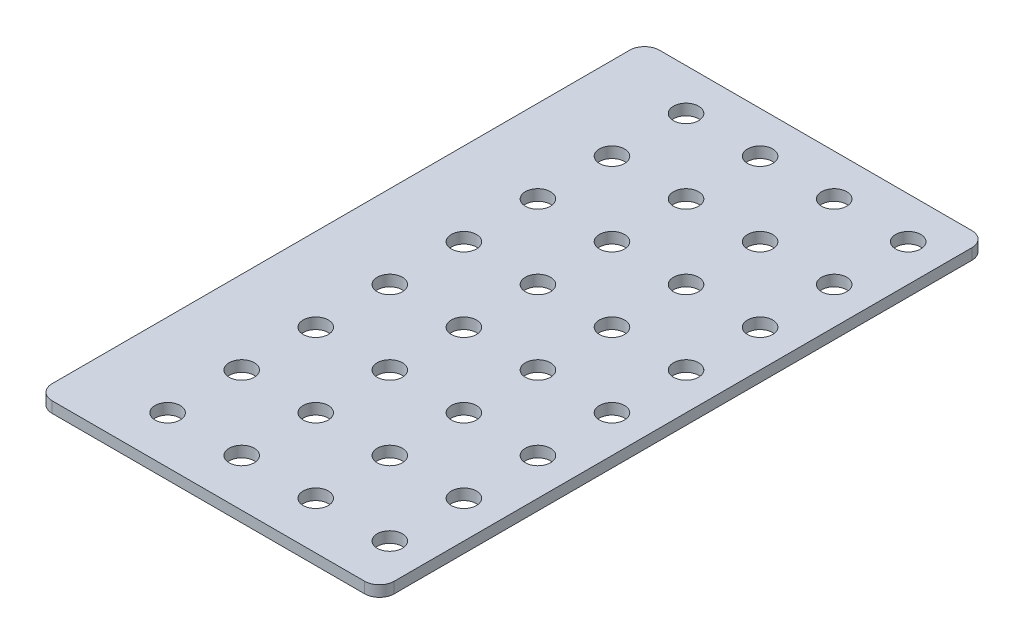
from build123d import *

# Parameters (mm, degrees)
SKETCH1_R           = 4.25
BOSS_EXTRUDE1_DEPTH = 3.7
FILLET1_R           = 5


with BuildPart() as part:
    # Sketch1 → Boss-Extrude1 (new body)
    with BuildSketch(Plane(origin=(0, 0, 0), x_dir=(1, 0, 0), z_dir=(0, 1, 0))):
        with BuildLine():
            Line((37.5, -116), (37.5, 89))
            Line((37.5, 89), (-73, 89))
            ThreePointArc((-73, 89), (-76.535533906, 87.535533906), (-78, 84))
            Line((-78, 84), (-78, -111))
            ThreePointArc((-78, -111), (-76.535533906, -114.535533906), (-73, -116))
            Line((-73, -116), (37.5, -116))
        make_face()
        with Locations(Location((-50, -100, 0), (0, 0, 270))):
            Circle(SKETCH1_R, mode=Mode.SUBTRACT)
        with Locations(Location((-50, -75, 0), (0, 0, 270))):
            Circle(SKETCH1_R, mode=Mode.SUBTRACT)
        with Locations(Location((-25, -100, 0), (0, 0, 270))):
            Circle(SKETCH1_R, mode=Mode.SUBTRACT)
        with Locations(Location((-25, -75, 0), (0, 0, 270))):
            Circle(SKETCH1_R, mode=Mode.SUBTRACT)
        with Locations(Location((0, -100, 0), (0, 0, 270))):
            Circle(SKETCH1_R, mode=Mode.SUBTRACT)
        with Locations(Location((0, -75, 0), (0, 0, 270))):
            Circle(SKETCH1_R, mode=Mode.SUBTRACT)
        with Locations(Location((-50, -50, 0), (0, 0, 270))):
            Circle(SKETCH1_R, mode=Mode.SUBTRACT)
        with Locations(Location((-50, -25, 0), (0, 0, 270))):
            Circle(SKETCH1_R, mode=Mode.SUBTRACT)
        with Locations(Location((-25, -50, 0), (0, 0, 270))):
            Circle(SKETCH1_R, mode=Mode.SUBTRACT)
        with Locations(Location((0, -50, 0), (0, 0, 270))):
            Circle(SKETCH1_R, mode=Mode.SUBTRACT)
        with Locations(Location((-25, -25, 0), (0, 0, 270))):
            Circle(SKETCH1_R, mode=Mode.SUBTRACT)
        with Locations(Location((0, -25, 0), (0, 0, 270))):
            Circle(SKETCH1_R, mode=Mode.SUBTRACT)
        with Locations(Location((25, -100, 0), (0, 0, 270))):
            Circle(SKETCH1_R, mode=Mode.SUBTRACT)
        with Locations(Location((25, -75, 0), (0, 0, 270))):
            Circle(SKETCH1_R, mode=Mode.SUBTRACT)
        with Locations(Location((25, -50, 0), (0, 0, 270))):
            Circle(SKETCH1_R, mode=Mode.SUBTRACT)
        with Locations(Location((25, -25, 0), (0, 0, 270))):
            Circle(SKETCH1_R, mode=Mode.SUBTRACT)
        with Locations(Location((-50, 0, 0), (0, 0, 270))):
            Circle(SKETCH1_R, mode=Mode.SUBTRACT)
        with Locations(Location((-50, 25, 0), (0, 0, 270))):
            Circle(SKETCH1_R, mode=Mode.SUBTRACT)
        with Locations(Location((-25, 0, 0), (0, 0, 270))):
            Circle(SKETCH1_R, mode=Mode.SUBTRACT)
        with Locations(Location((0, 0, 0), (0, 0, 270))):
            Circle(SKETCH1_R, mode=Mode.SUBTRACT)
        with Locations(Location((-25, 25, 0), (0, 0, 270))):
            Circle(SKETCH1_R, mode=Mode.SUBTRACT)
        with Locations(Location((0, 25, 0), (0, 0, 270))):
            Circle(SKETCH1_R, mode=Mode.SUBTRACT)
        with Locations(Location((-50, 50, 0), (0, 0, 270))):
            Circle(SKETCH1_R, mode=Mode.SUBTRACT)
        with Locations(Location((-50, 75, 0), (0, 0, 270))):
            Circle(SKETCH1_R, mode=Mode.SUBTRACT)
        with Locations(Location((-25, 50, 0), (0, 0, 270))):
            Circle(SKETCH1_R, mode=Mode.SUBTRACT)
        with Locations(Location((-25, 75, 0), (0, 0, 270))):
            Circle(SKETCH1_R, mode=Mode.SUBTRACT)
        with Locations(Location((0, 50, 0), (0, 0, 270))):
            Circle(SKETCH1_R, mode=Mode.SUBTRACT)
        with Locations(Location((0, 75, 0), (0, 0, 270))):
            Circle(SKETCH1_R, mode=Mode.SUBTRACT)
        with Locations(Location((25, 0, 0), (0, 0, 270))):
            Circle(SKETCH1_R, mode=Mode.SUBTRACT)
        with Locations(Location((25, 25, 0), (0, 0, 270))):
            Circle(SKETCH1_R, mode=Mode.SUBTRACT)
        with Locations(Location((25, 50, 0), (0, 0, 270))):
            Circle(SKETCH1_R, mode=Mode.SUBTRACT)
        with Locations(Location((25, 75, 0), (0, 0, 270))):
            Circle(SKETCH1_R, mode=Mode.SUBTRACT)
    extrude(amount=BOSS_EXTRUDE1_DEPTH)

    # Fillet1
    fillet1_edges = [part.edges().sort_by_distance(p)[0] for p in [
        (37.5, 1.85, -89),
        (37.5, 1.85, 116),
    ]]
    fillet(fillet1_edges, radius=FILLET1_R)


solid = part.part
